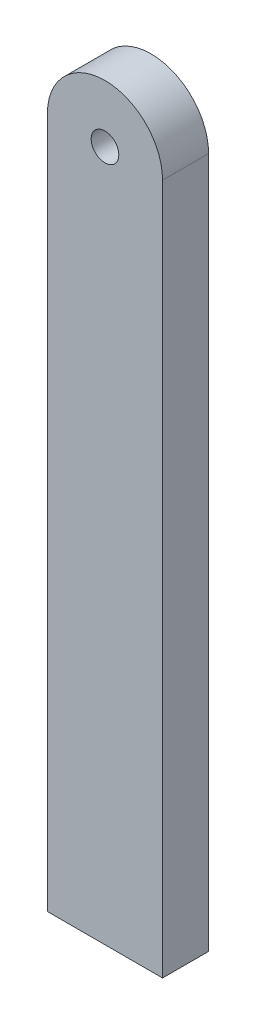
from build123d import *

# Parameters (mm, degrees)
SKETCH1_R           = 3
BOSS_EXTRUDE1_DEPTH = 10


with BuildPart() as part:
    # Sketch1 → Boss-Extrude1 (new body)
    with BuildSketch(Plane.XY):
        with BuildLine():
            Line((-12.5, -75), (12.5, -75))
            Line((12.5, -75), (12.5, 75))
            ThreePointArc((12.5, 75), (0, 87.5), (-12.5, 75))
            Line((-12.5, 75), (-12.5, -75))
        make_face()
        with Locations((0, 75)):
            Circle(SKETCH1_R, mode=Mode.SUBTRACT)
    extrude(amount=BOSS_EXTRUDE1_DEPTH)


solid = part.part
